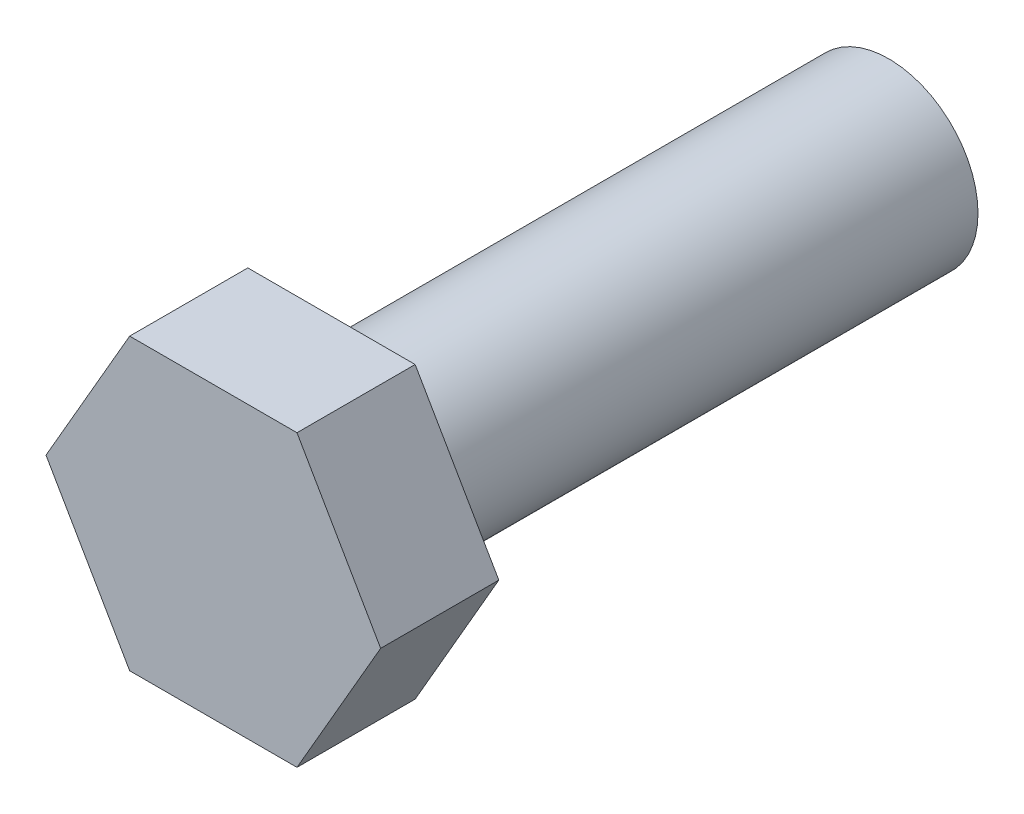
from build123d import *

# Parameters (mm, degrees)
SKETCH1_R      = 4
EXTRUDE1_DEPTH = 25
EXTRUDE2_DEPTH = 5.3


with BuildPart() as part:
    # Sketch1 → Extrude1 (new body)
    with BuildSketch(Plane.XY):
        Circle(SKETCH1_R)
    extrude(amount=-EXTRUDE1_DEPTH)

    # Sketch2 → Extrude2 (add)
    with BuildSketch(Plane.XY):
        Polygon((-3.75277675, 6.5), (-7.505553499, 0), (-3.75277675, -6.5), (3.75277675, -6.5), (7.505553499, 0), (3.75277675, 6.5), align=None)
    extrude(amount=EXTRUDE2_DEPTH)


solid = part.part
